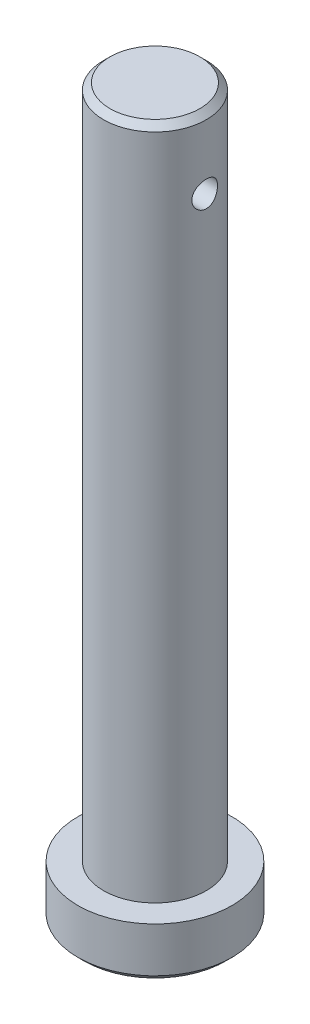
from build123d import *

# Parameters (mm, degrees)
SKETCH1_R           = 12
BOSS_EXTRUDE1_DEPTH = 8
CHAMFER1_SIZE       = 1
SKETCH2_R           = 8
BOSS_EXTRUDE2_DEPTH = 105
CHAMFER2_SIZE       = 1
SKETCH3_R           = 2
CUT_EXTRUDE1_DEPTH  = 52.5


with BuildPart() as part:
    # Sketch1 → Boss-Extrude1 (new body)
    with BuildSketch(Plane(origin=(0, 0, 0), x_dir=(1, 0, 0), z_dir=(0, 1, 0))):
        with Locations(Location((0, 0, 0), (0, 0, 270))):
            Circle(SKETCH1_R)
    extrude(amount=BOSS_EXTRUDE1_DEPTH)

    # Chamfer1
    chamfer1_edges = [part.edges().sort_by_distance(p)[0] for p in [
        (0, 0, -12),
    ]]
    chamfer(chamfer1_edges, length=CHAMFER1_SIZE)

    # Sketch2 → Boss-Extrude2 (add)
    with BuildSketch(Plane(origin=(0, 8, 0), x_dir=(1, 0, 0), z_dir=(0, 1, 0))):
        with Locations(Location((0, 0, 0), (0, 0, 270))):
            Circle(SKETCH2_R)
    extrude(amount=BOSS_EXTRUDE2_DEPTH)

    # Chamfer2
    chamfer2_edges = [part.edges().sort_by_distance(p)[0] for p in [
        (0, 113, -8),
    ]]
    chamfer(chamfer2_edges, length=CHAMFER2_SIZE)

    # Sketch3 → Cut-Extrude1 (cut, symmetric)
    with BuildSketch(Plane(origin=(0, 0, 0), x_dir=(0, 0, -1), z_dir=(1, 0, 0))):
        with Locations((0, 102)):
            Circle(SKETCH3_R)
    extrude(amount=CUT_EXTRUDE1_DEPTH, both=True, mode=Mode.SUBTRACT)


solid = part.part
